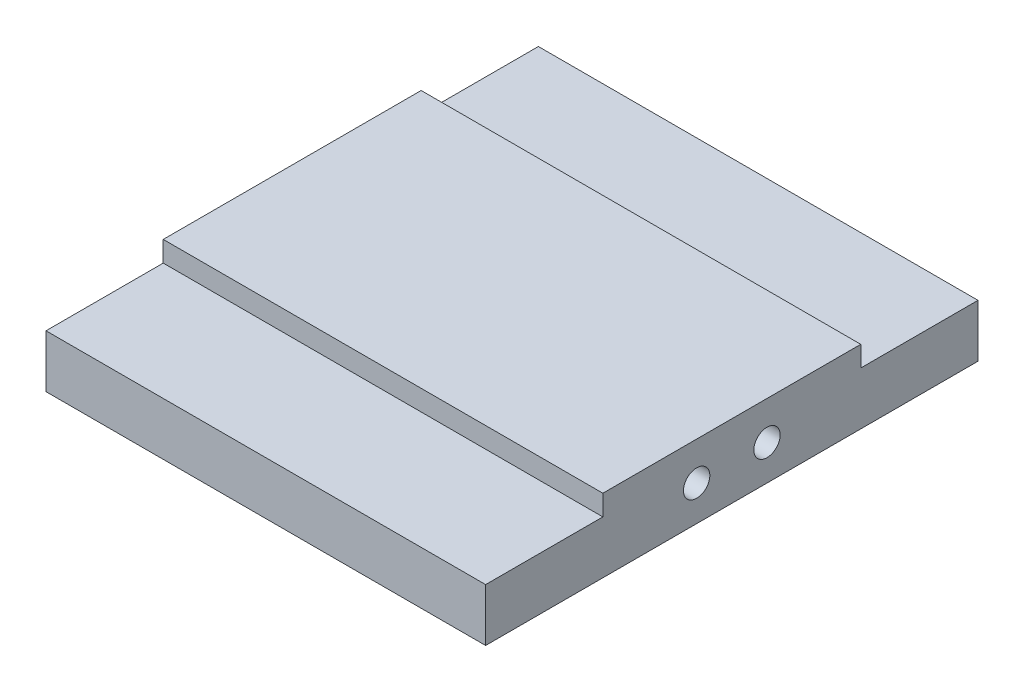
from build123d import *

# Parameters (mm, degrees)
SKETCH1_W           = 75
SKETCH1_H           = 84
BOSS_EXTRUDE1_DEPTH = 12.5
SKETCH2_W           = 6.25
SKETCH2_H           = 22
CUT_EXTRUDE1_DEPTH  = 12
SKETCH3_R           = 2.25
CUT_EXTRUDE2_DEPTH  = 87.863398506
SKETCH4_W           = 75
SKETCH4_H           = 20
CUT_EXTRUDE3_DEPTH  = 3.5


with BuildPart() as part:
    # Sketch1 → Boss-Extrude1 (new body)
    with BuildSketch(Plane(origin=(0, 0, 0), x_dir=(1, 0, 0), z_dir=(0, 1, 0))):
        Rectangle(SKETCH1_W, SKETCH1_H)
    extrude(amount=BOSS_EXTRUDE1_DEPTH)

    # Sketch2 → Cut-Extrude1 (cut)
    with BuildSketch(Plane.XZ):
        with Locations((24.375, 0)):
            Rectangle(SKETCH2_W, SKETCH2_H)
    extrude(amount=-CUT_EXTRUDE1_DEPTH, mode=Mode.SUBTRACT)

    # Sketch3 → Cut-Extrude2 (cut, through all)
    with BuildSketch(Plane(origin=(37.5, 0, 0), x_dir=(0, 0, -1), z_dir=(1, 0, 0))):
        with Locations((-6, 6)):
            Circle(SKETCH3_R)
        with Locations((6, 6)):
            Circle(SKETCH3_R)
    extrude(amount=-CUT_EXTRUDE2_DEPTH, mode=Mode.SUBTRACT)

    # Sketch4 → Cut-Extrude3 (cut)
    with BuildSketch(Plane(origin=(0, 12.5, 0), x_dir=(1, 0, 0), z_dir=(0, 1, 0))):
        with Locations((0, 32)):
            Rectangle(SKETCH4_W, SKETCH4_H)
        with Locations((0, -32)):
            Rectangle(SKETCH4_W, SKETCH4_H)
    extrude(amount=-CUT_EXTRUDE3_DEPTH, mode=Mode.SUBTRACT)


solid = part.part
